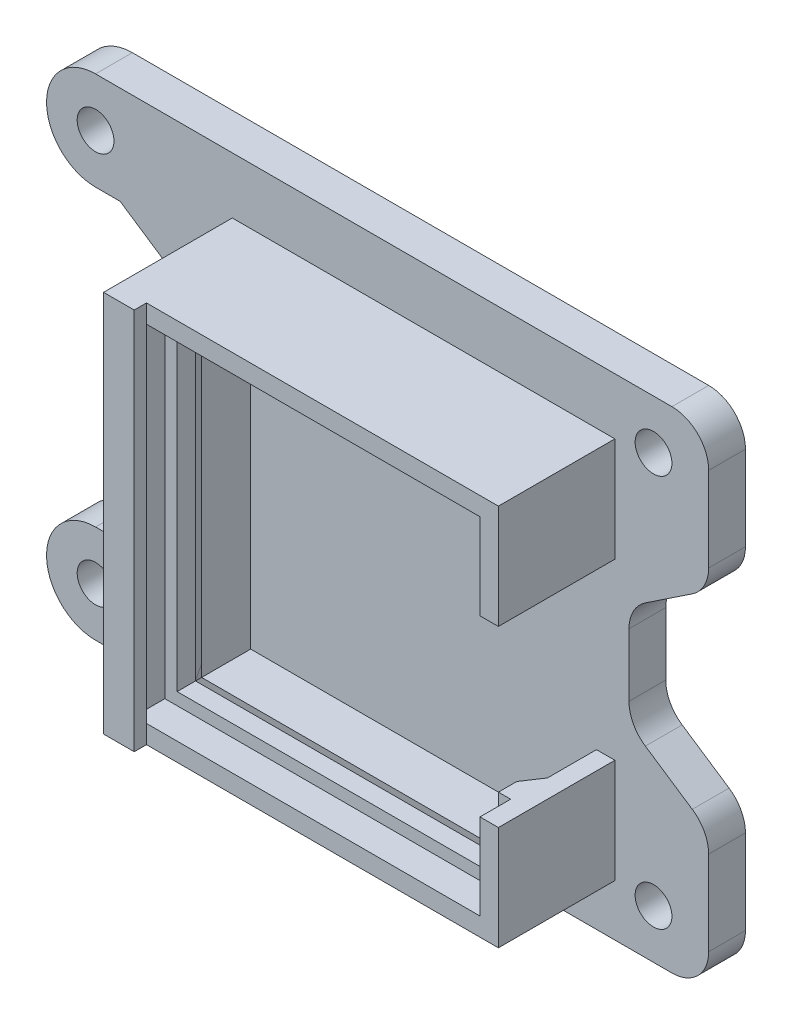
from build123d import *

# Parameters (mm, degrees)
CROQUIS1_R              = 1.5
SALIENTE_EXTRUIR1_DEPTH = 3
CROQUIS2_W              = 31.2
CROQUIS2_H              = 31.2
CROQUIS2_W_2            = 28.2
CROQUIS2_H_2            = 28.2
SALIENTE_EXTRUIR2_DEPTH = 9.5
CROQUIS4_W              = 28.2
CROQUIS4_H              = 28.2
CROQUIS4_W_2            = 26.2
CROQUIS4_H_2            = 26.2
SALIENTE_EXTRUIR3_DEPTH = 3
CORTAR_EXTRUIR1_REACH   = 69.732
CROQUIS8_W              = 7.2
CROQUIS8_H              = 1
CORTAR_EXTRUIR2_START   = -9.5
CROQUIS9_W              = 5.627722912
CROQUIS9_H              = 14.2
CORTAR_EXTRUIR2_DEPTH   = 9.5
CROQUIS10_W             = 2.5
CROQUIS10_H             = 31.2
SALIENTE_EXTRUIR4_DEPTH = 1


with BuildPart() as part:
    # Croquis1 → Saliente-Extruir1 (new body)
    with BuildSketch(Plane.XY):
        with BuildLine():
            Line((-52.197309417, 4.461883408), (-50.197309417, 4.461883408))
            Line((-50.197309417, 4.461883408), (-44.197309417, 8.461883408))
            Line((-44.197309417, 8.461883408), (-44.197309417, 24.461883408))
            Line((-44.197309417, 24.461883408), (-50.197309417, 28.461883408))
            Line((-50.197309417, 28.461883408), (-52.197309417, 28.461883408))
            ThreePointArc((-52.197309417, 28.461883408), (-56.197309417, 32.461883408), (-52.197309417, 36.461883408))
            Line((-52.197309417, 36.461883408), (-5.197309417, 36.461883408))
            ThreePointArc((-5.197309417, 36.461883408), (-3.075989073, 35.583203752), (-2.197309417, 33.461883408))
            Line((-2.197309417, 33.461883408), (-2.197309417, 26.567434684))
            ThreePointArc((-2.197309417, 26.567434684), (-2.552285621, 25.151860907), (-3.533208828, 24.071283801))
            Line((-3.533208828, 24.071283801), (-7.361410006, 21.519149682))
            ThreePointArc((-7.361410006, 21.519149682), (-8.342333213, 20.438572576), (-8.697309417, 19.022998799))
            Line((-8.697309417, 19.022998799), (-8.697309417, 13.900768017))
            ThreePointArc((-8.697309417, 13.900768017), (-8.342333213, 12.48519424), (-7.361410006, 11.404617134))
            Line((-7.361410006, 11.404617134), (-3.533208828, 8.852483016))
            ThreePointArc((-3.533208828, 8.852483016), (-2.552285621, 7.771905909), (-2.197309417, 6.356332133))
            Line((-2.197309417, 6.356332133), (-2.197309417, -0.538116592))
            ThreePointArc((-2.197309417, -0.538116592), (-3.075989073, -2.659436935), (-5.197309417, -3.538116592))
            Line((-5.197309417, -3.538116592), (-52.197309417, -3.538116592))
            ThreePointArc((-52.197309417, -3.538116592), (-56.197309417, 0.461883408), (-52.197309417, 4.461883408))
        make_face()
        with Locations((-6.697309417, 32.461883408)):
            Circle(CROQUIS1_R, mode=Mode.SUBTRACT)
        with Locations((-52.197309417, 0.461883408)):
            Circle(CROQUIS1_R, mode=Mode.SUBTRACT)
        with Locations((-6.697309417, 0.461883408)):
            Circle(CROQUIS1_R, mode=Mode.SUBTRACT)
        with Locations((-52.197309417, 32.461883408)):
            Circle(CROQUIS1_R, mode=Mode.SUBTRACT)
    extrude(amount=SALIENTE_EXTRUIR1_DEPTH)

    # Croquis2 → Saliente-Extruir2 (add)
    with BuildSketch(Plane.XY.offset(3)):
        with Locations((-25.447309417, 16.261883408)):
            Rectangle(CROQUIS2_W, CROQUIS2_H)
        with Locations((-25.447309417, 16.261883408)):
            Rectangle(CROQUIS2_W_2, CROQUIS2_H_2, mode=Mode.SUBTRACT)
    extrude(amount=SALIENTE_EXTRUIR2_DEPTH)

    # Croquis4 → Saliente-Extruir3 (add)
    with BuildSketch(Plane.XY.offset(7)):
        with Locations((-25.447309417, 16.261883408)):
            Rectangle(CROQUIS4_W, CROQUIS4_H)
        with Locations((-25.447309417, 16.261883408)):
            Rectangle(CROQUIS4_W_2, CROQUIS4_H_2, mode=Mode.SUBTRACT)
    extrude(amount=SALIENTE_EXTRUIR3_DEPTH)

    # Cortar-Barrer1: sweep along a path in Croquis7
    with BuildLine(Plane.XY.offset(10)) as cortar_barrer1_path:
        Line((-39.047309417, 29.861883408), (-11.847309417, 29.861883408))
        Line((-11.847309417, 29.861883408), (-11.847309417, 2.661883408))
        Line((-11.847309417, 2.661883408), (-39.047309417, 2.661883408))
        Line((-39.047309417, 2.661883408), (-39.047309417, 29.861883408))
    # Croquis6 → Cortar-Barrer1 (sweep, cut)
    with BuildSketch(Plane(origin=(0, 3.161883408, 0), x_dir=(-1, 0, 0), z_dir=(0, -1, 0))):
        Polygon((38.547309417, -8.5), (38.547309417, -7), (39.547309417, -7), align=None)
    sweep(path=cortar_barrer1_path.line, transition=Transition.RIGHT, mode=Mode.SUBTRACT)

    # Cortar-Extruir1: up to this plane
    cortar_extruir1_end = Plane(origin=(-39.697309417, 30.361883408, 7), z_dir=(0, -0.8320502943378436, -0.5547001962252293))
    # Croquis8 → Cortar-Extruir1 (cut, up to the surface)
    with BuildSketch(Plane.XY.offset(10), mode=Mode.PRIVATE) as cortar_extruir1_sk1:
        with Locations((-26.947309417, 29.861883408)):
            Rectangle(CROQUIS8_W, CROQUIS8_H)
    cortar_extruir1_tool1 = split(extrude(cortar_extruir1_sk1.sketch, amount=-CORTAR_EXTRUIR1_REACH, mode=Mode.PRIVATE), bisect_by=cortar_extruir1_end, keep=Keep.BOTH, mode=Mode.PRIVATE)
    add(cortar_extruir1_tool1.solids().sort_by_distance((-26.947309, 29.861883, 10))[0], mode=Mode.SUBTRACT)

    # Croquis9 → Cortar-Extruir2 (cut)
    with BuildSketch(Plane.XY.offset(12.5).offset(CORTAR_EXTRUIR2_START)):
        with Locations((-12.661170873, 16.261883408)):
            Rectangle(CROQUIS9_W, CROQUIS9_H)
    extrude(amount=CORTAR_EXTRUIR2_DEPTH, mode=Mode.SUBTRACT)

    # Croquis10 → Saliente-Extruir4 (add)
    with BuildSketch(Plane.XY.offset(12.5)):
        with Locations((-39.797309417, 16.261883408)):
            Rectangle(CROQUIS10_W, CROQUIS10_H)
    extrude(amount=SALIENTE_EXTRUIR4_DEPTH)


solid = part.part
